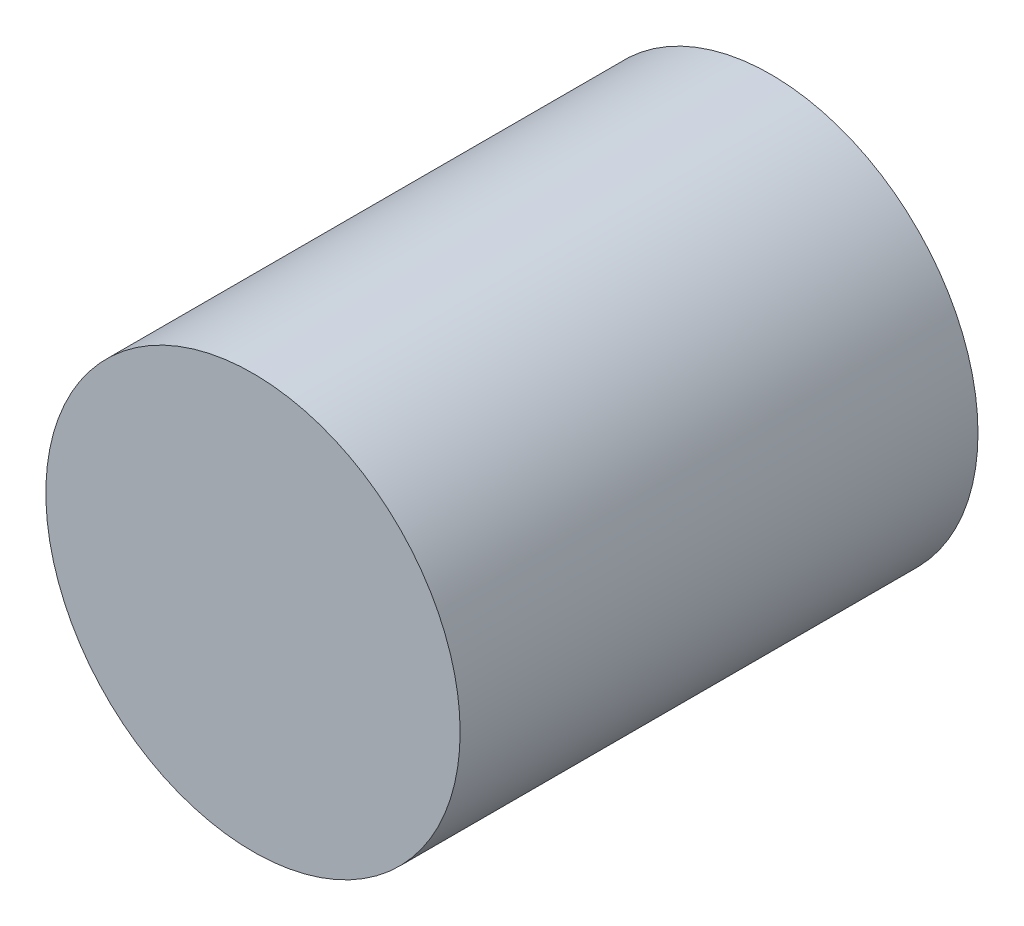
from build123d import *

# Parameters (mm, degrees)
SKETCH1_W = 10
SKETCH1_H = 25


with BuildPart() as part:
    # Sketch1 → Revolve1 (revolve)
    with BuildSketch(Plane(origin=(0, 0, 0), x_dir=(1, 0, 0), z_dir=(0, 1, 0))):
        with Locations((5, 12.5)):
            Rectangle(SKETCH1_W, SKETCH1_H)
    revolve(axis=Axis((0, 0, 0), (0, 0, -1)))


solid = part.part
